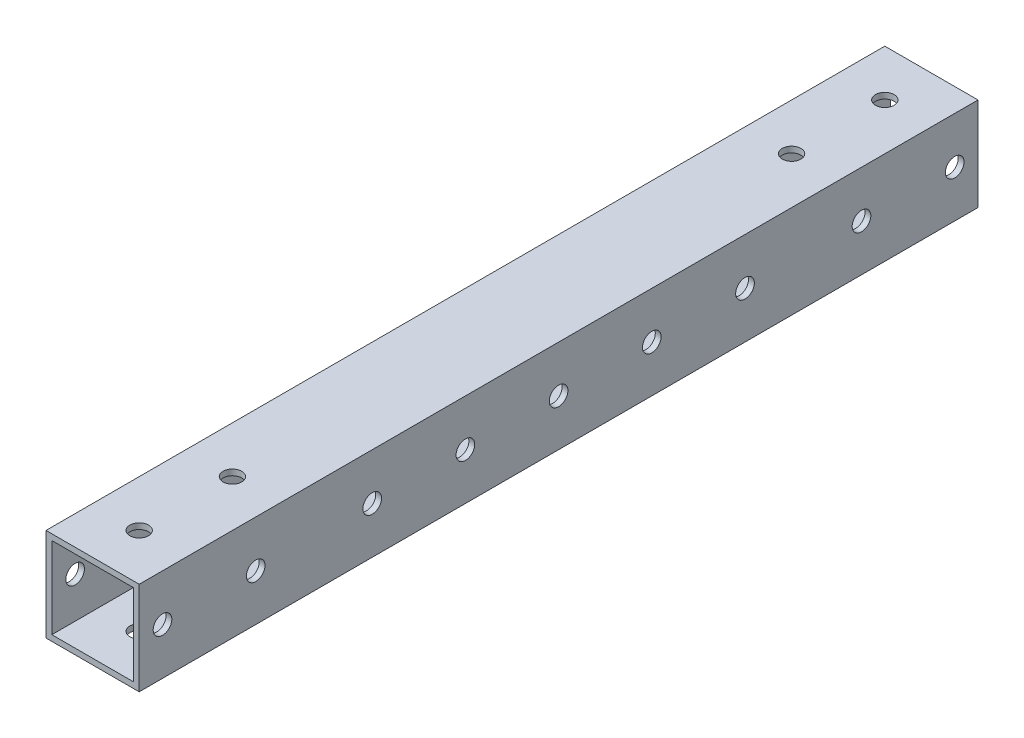
from build123d import *

# Parameters (mm, degrees)
SKETCH1_W           = 25.4
SKETCH1_H           = 25.4
SKETCH1_W_2         = 22.225
SKETCH1_H_2         = 22.225
BOSS_EXTRUDE1_DEPTH = 228.6
SKETCH3_R           = 2.54
CUT_EXTRUDE2_DEPTH  = 232.40501291
SKETCH4_R           = 2.54
CUT_EXTRUDE3_DEPTH  = 232.40501291


with BuildPart() as part:
    # Sketch1 → Boss-Extrude1 (new body)
    with BuildSketch(Plane.XY):
        with Locations((12.7, 12.7)):
            Rectangle(SKETCH1_W, SKETCH1_H)
        with Locations((12.7, 12.7)):
            Rectangle(SKETCH1_W_2, SKETCH1_H_2, mode=Mode.SUBTRACT)
    extrude(amount=BOSS_EXTRUDE1_DEPTH)

    # Sketch3 → Cut-Extrude2 (cut, through all)
    with BuildSketch(Plane(origin=(0, 25.4, 0), x_dir=(1, 0, 0), z_dir=(0, 1, 0))):
        with Locations(Location((12.7, -215.9, 0), (0, 0, 270))):
            Circle(SKETCH3_R)
        with Locations(Location((12.7, -190.5, 0), (0, 0, 270))):
            Circle(SKETCH3_R)
        with Locations(Location((12.7, -12.7, 0), (0, 0, 90))):
            Circle(SKETCH3_R)
        with Locations(Location((12.7, -38.1, 0), (0, 0, 90))):
            Circle(SKETCH3_R)
    extrude(amount=-CUT_EXTRUDE2_DEPTH, mode=Mode.SUBTRACT)

    # Sketch4 → Cut-Extrude3 (cut, through all)
    with BuildSketch(Plane(origin=(25.4, 0, 0), x_dir=(0, 0, -1), z_dir=(1, 0, 0))):
        with Locations((-222.25, 12.7)):
            Circle(SKETCH4_R)
        with Locations((-196.85, 12.7)):
            Circle(SKETCH4_R)
        with Locations(Location((-31.75, 12.7, 0), (0, 0, 180))):
            Circle(SKETCH4_R)
        with Locations(Location((-6.35, 12.7, 0), (0, 0, 180))):
            Circle(SKETCH4_R)
        with Locations((-114.3, 12.7)):
            Circle(SKETCH4_R)
        with Locations((-88.9, 12.7)):
            Circle(SKETCH4_R)
        with Locations((-63.5, 12.7)):
            Circle(SKETCH4_R)
        with Locations((-139.7, 12.7)):
            Circle(SKETCH4_R)
        with Locations((-165.1, 12.7)):
            Circle(SKETCH4_R)
    extrude(amount=-CUT_EXTRUDE3_DEPTH, mode=Mode.SUBTRACT)


solid = part.part
